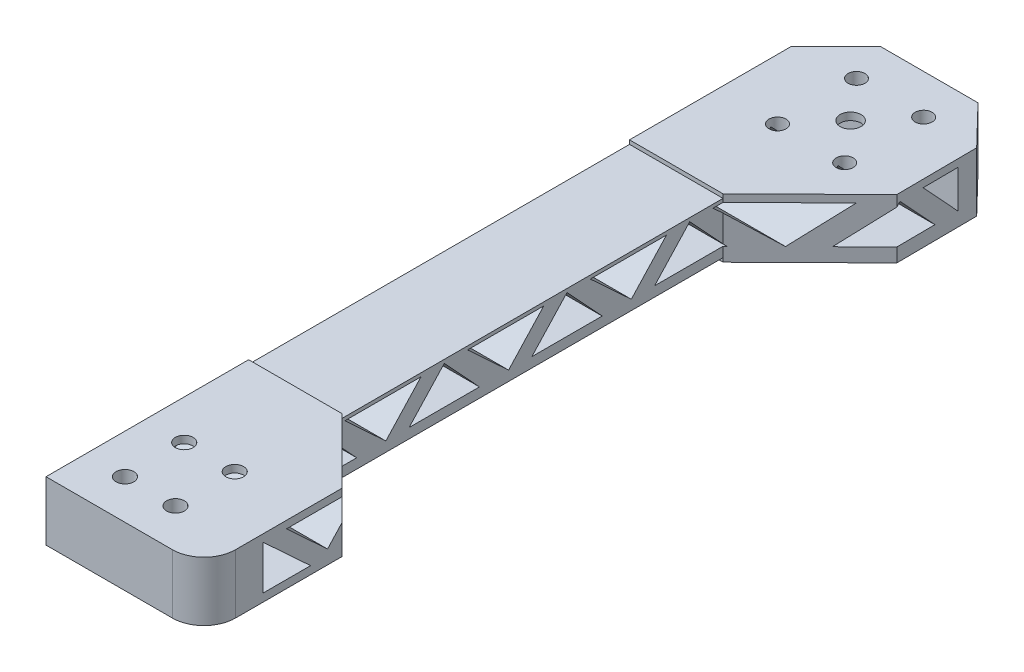
from build123d import *

# Parameters (mm, degrees)
SKETCH1_R           = 2.25
SKETCH1_R_2         = 2.65
SKETCH1_R_3         = 2.15
BOSS_EXTRUDE1_DEPTH = 15
CUT_EXTRUDE2_DEPTH  = 46
SKETCH3_W           = 23.685590182
SKETCH3_H           = 96.44516038
CUT_EXTRUDE4_DEPTH  = 1
SKETCH4_W           = 23.685590182
SKETCH4_H           = 96.44516038
CUT_EXTRUDE5_DEPTH  = 1


with BuildPart() as part:
    # Sketch1 → Boss-Extrude1 (new body)
    with BuildSketch(Plane(origin=(0, 0, 0), x_dir=(1, 0, 0), z_dir=(0, 1, 0))):
        with BuildLine():
            Line((-15.264606027, -1.25325428), (-15.264606027, -189.971404395))
            Line((-15.264606027, -189.971404395), (16.735393973, -189.971404395))
            ThreePointArc((16.735393973, -189.971404395), (22.392248222, -187.628258644), (24.735393973, -181.971404395))
            Line((24.735393973, -181.971404395), (24.735393973, -154.971404395))
            Line((24.735393973, -154.971404395), (8.420984155, -138.656994577))
            Line((8.420984155, -138.656994577), (8.420984155, -42.211834197))
            Line((8.420984155, -42.211834197), (30.584014254, -20.376885374))
            Line((30.584014254, -20.376885374), (30.429434292, 0))
            Line((30.429434292, 0), (20.736580617, 10.028595605))
            Line((20.736580617, 10.028595605), (-3.982756142, 10.028595605))
            Line((-3.982756142, 10.028595605), (-15.264606027, -1.25325428))
        make_face()
        with Locations(Location((-5.264606027, -179.971404395, 0), (0, 0, 270))):
            Circle(SKETCH1_R, mode=Mode.SUBTRACT)
        with Locations(Location((7.525634834, -179.971404395, 0), (0, 0, 270))):
            Circle(SKETCH1_R, mode=Mode.SUBTRACT)
        with Locations(Location((-5.264606027, -164.971404395, 0), (0, 0, 270))):
            Circle(SKETCH1_R, mode=Mode.SUBTRACT)
        with Locations(Location((7.525634834, -164.971404395, 0), (0, 0, 270))):
            Circle(SKETCH1_R, mode=Mode.SUBTRACT)
        with Locations(Location((8.5, -10, 0), (0, 0, 270))):
            Circle(SKETCH1_R_2, mode=Mode.SUBTRACT)
        with Locations(Location((0, 0, 0), (0, 0, 270))):
            Circle(SKETCH1_R_3, mode=Mode.SUBTRACT)
        with Locations(Location((17, 0, 0), (0, 0, 270))):
            Circle(SKETCH1_R_3, mode=Mode.SUBTRACT)
        with Locations(Location((0, -20, 0), (0, 0, 270))):
            Circle(SKETCH1_R_3, mode=Mode.SUBTRACT)
        with Locations(Location((17, -20, 0), (0, 0, 270))):
            Circle(SKETCH1_R_3, mode=Mode.SUBTRACT)
    extrude(amount=BOSS_EXTRUDE1_DEPTH)

    # Sketch2 → Cut-Extrude2 (cut)
    with BuildSketch(Plane.ZY.offset(15.264606027)):
        Polygon((174.971404395, 13.113981192), (174.971404395, 2), (162.971404395, 2), align=None)
        Polygon((149.78200197, 13.113981192), (169.066554165, 13.113981192), (158.686135815, 3.5), align=None)
        Polygon((4.75786812, 3.5), (4.75786812, 13.113981192), (13.66200197, 13.113981192), align=None)
        Polygon((143.88200197, 13.113981192), (152.786135815, 3.5), (143.88200197, 3.5), (134.97786812, 3.5), align=None)
        Polygon((112.80200197, 13.113981192), (121.706135815, 3.5), (112.80200197, 3.5), (103.89786812, 3.5), align=None)
        Polygon((81.72200197, 13.113981192), (90.626135815, 3.5), (81.72200197, 3.5), (72.81786812, 3.5), align=None)
        Polygon((50.64200197, 13.113981192), (59.546135815, 3.5), (50.64200197, 3.5), (41.73786812, 3.5), align=None)
        Polygon((19.56200197, 13.113981192), (28.466135815, 3.5), (19.56200197, 3.5), (10.65786812, 3.5), align=None)
        Polygon((137.986554165, 13.113981192), (127.606135815, 3.5), (118.70200197, 13.113981192), align=None)
        Polygon((106.906554165, 13.113981192), (96.526135815, 3.5), (87.62200197, 13.113981192), align=None)
        Polygon((75.826554165, 13.113981192), (65.446135815, 3.5), (56.54200197, 13.113981192), align=None)
        Polygon((44.746554165, 13.113981192), (34.366135815, 3.5), (25.46200197, 13.113981192), align=None)
    extrude(amount=-CUT_EXTRUDE2_DEPTH, mode=Mode.SUBTRACT)

    # Sketch3 → Cut-Extrude4 (cut)
    with BuildSketch(Plane.XZ):
        with Locations((-3.421810936, 90.434414387)):
            Rectangle(SKETCH3_W, SKETCH3_H)
    extrude(amount=-CUT_EXTRUDE4_DEPTH, mode=Mode.SUBTRACT)

    # Sketch4 → Cut-Extrude5 (cut)
    with BuildSketch(Plane(origin=(0, 15, 0), x_dir=(1, 0, 0), z_dir=(0, 1, 0))):
        with Locations((-3.421810936, -90.434414387)):
            Rectangle(SKETCH4_W, SKETCH4_H)
    extrude(amount=-CUT_EXTRUDE5_DEPTH, mode=Mode.SUBTRACT)


solid = part.part
